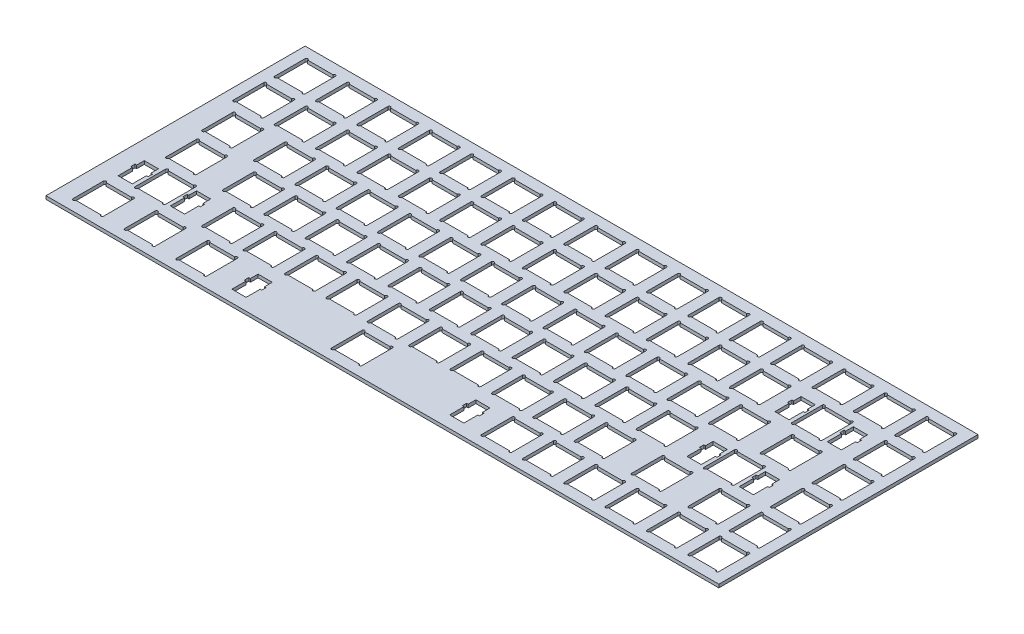
from build123d import *

# Parameters (mm, degrees)
SKETCH_1_W      = 309
SKETCH_1_H      = 119
EXTRUDE_1_DEPTH = 1.5


with BuildPart() as part:
    # Эскиз1 → Бобышка-Вытянуть1 (new body)
    with BuildSketch(Plane(origin=(0, 0, 0), x_dir=(1, 0, 0), z_dir=(0, 1, 0))):
        with Locations((142.5, -47.5)):
            Rectangle(SKETCH_1_W, SKETCH_1_H)
        with BuildLine():
            Line((13.2, -7), (24.8, -7))
            ThreePointArc((24.8, -7), (25.4, -7.6), (26, -7))
            Line((26, -7), (26, 7))
            ThreePointArc((26, 7), (25.4, 7.6), (24.8, 7))
            Line((24.8, 7), (13.2, 7))
            ThreePointArc((13.2, 7), (12.6, 7.6), (12, 7))
            Line((12, 7), (12, -7))
            ThreePointArc((12, -7), (12.6, -7.6), (13.2, -7))
        make_face(mode=Mode.SUBTRACT)
        with BuildLine():
            Line((-7, 7), (-7, -7))
            ThreePointArc((-7, -7), (-6.4, -7.6), (-5.8, -7))
            Line((-5.8, -7), (5.8, -7))
            ThreePointArc((5.8, -7), (6.4, -7.6), (7, -7))
            Line((7, -7), (7, 7))
            ThreePointArc((7, 7), (6.4, 7.6), (5.8, 7))
            Line((5.8, 7), (-5.8, 7))
            ThreePointArc((-5.8, 7), (-6.4, 7.6), (-7, 7))
        make_face(mode=Mode.SUBTRACT)
        with BuildLine():
            Line((32.2, -7), (43.8, -7))
            ThreePointArc((43.8, -7), (44.4, -7.6), (45, -7))
            Line((45, -7), (45, 7))
            ThreePointArc((45, 7), (44.4, 7.6), (43.8, 7))
            Line((43.8, 7), (32.2, 7))
            ThreePointArc((32.2, 7), (31.6, 7.6), (31, 7))
            Line((31, 7), (31, -7))
            ThreePointArc((31, -7), (31.6, -7.6), (32.2, -7))
        make_face(mode=Mode.SUBTRACT)
        with BuildLine():
            Line((51.2, -7), (62.8, -7))
            ThreePointArc((62.8, -7), (63.4, -7.6), (64, -7))
            Line((64, -7), (64, 7))
            ThreePointArc((64, 7), (63.4, 7.6), (62.8, 7))
            Line((62.8, 7), (51.2, 7))
            ThreePointArc((51.2, 7), (50.6, 7.6), (50, 7))
            Line((50, 7), (50, -7))
            ThreePointArc((50, -7), (50.6, -7.6), (51.2, -7))
        make_face(mode=Mode.SUBTRACT)
        with BuildLine():
            Line((70.2, -7), (81.8, -7))
            ThreePointArc((81.8, -7), (82.4, -7.6), (83, -7))
            Line((83, -7), (83, 7))
            ThreePointArc((83, 7), (82.4, 7.6), (81.8, 7))
            Line((81.8, 7), (70.2, 7))
            ThreePointArc((70.2, 7), (69.6, 7.6), (69, 7))
            Line((69, 7), (69, -7))
            ThreePointArc((69, -7), (69.6, -7.6), (70.2, -7))
        make_face(mode=Mode.SUBTRACT)
        with BuildLine():
            Line((89.2, -7), (100.8, -7))
            ThreePointArc((100.8, -7), (101.4, -7.6), (102, -7))
            Line((102, -7), (102, 7))
            ThreePointArc((102, 7), (101.4, 7.6), (100.8, 7))
            Line((100.8, 7), (89.2, 7))
            ThreePointArc((89.2, 7), (88.6, 7.6), (88, 7))
            Line((88, 7), (88, -7))
            ThreePointArc((88, -7), (88.6, -7.6), (89.2, -7))
        make_face(mode=Mode.SUBTRACT)
        with BuildLine():
            Line((108.2, -7), (119.8, -7))
            ThreePointArc((119.8, -7), (120.4, -7.6), (121, -7))
            Line((121, -7), (121, 7))
            ThreePointArc((121, 7), (120.4, 7.6), (119.8, 7))
            Line((119.8, 7), (108.2, 7))
            ThreePointArc((108.2, 7), (107.6, 7.6), (107, 7))
            Line((107, 7), (107, -7))
            ThreePointArc((107, -7), (107.6, -7.6), (108.2, -7))
        make_face(mode=Mode.SUBTRACT)
        with BuildLine():
            Line((127.2, -7), (138.8, -7))
            ThreePointArc((138.8, -7), (139.4, -7.6), (140, -7))
            Line((140, -7), (140, 7))
            ThreePointArc((140, 7), (139.4, 7.6), (138.8, 7))
            Line((138.8, 7), (127.2, 7))
            ThreePointArc((127.2, 7), (126.6, 7.6), (126, 7))
            Line((126, 7), (126, -7))
            ThreePointArc((126, -7), (126.6, -7.6), (127.2, -7))
        make_face(mode=Mode.SUBTRACT)
        with BuildLine():
            Line((146.2, -7), (157.8, -7))
            ThreePointArc((157.8, -7), (158.4, -7.6), (159, -7))
            Line((159, -7), (159, 7))
            ThreePointArc((159, 7), (158.4, 7.6), (157.8, 7))
            Line((157.8, 7), (146.2, 7))
            ThreePointArc((146.2, 7), (145.6, 7.6), (145, 7))
            Line((145, 7), (145, -7))
            ThreePointArc((145, -7), (145.6, -7.6), (146.2, -7))
        make_face(mode=Mode.SUBTRACT)
        with BuildLine():
            Line((165.2, -7), (176.8, -7))
            ThreePointArc((176.8, -7), (177.4, -7.6), (178, -7))
            Line((178, -7), (178, 7))
            ThreePointArc((178, 7), (177.4, 7.6), (176.8, 7))
            Line((176.8, 7), (165.2, 7))
            ThreePointArc((165.2, 7), (164.6, 7.6), (164, 7))
            Line((164, 7), (164, -7))
            ThreePointArc((164, -7), (164.6, -7.6), (165.2, -7))
        make_face(mode=Mode.SUBTRACT)
        with BuildLine():
            Line((184.2, -7), (195.8, -7))
            ThreePointArc((195.8, -7), (196.4, -7.6), (197, -7))
            Line((197, -7), (197, 7))
            ThreePointArc((197, 7), (196.4, 7.6), (195.8, 7))
            Line((195.8, 7), (184.2, 7))
            ThreePointArc((184.2, 7), (183.6, 7.6), (183, 7))
            Line((183, 7), (183, -7))
            ThreePointArc((183, -7), (183.6, -7.6), (184.2, -7))
        make_face(mode=Mode.SUBTRACT)
        with BuildLine():
            Line((203.2, -7), (214.8, -7))
            ThreePointArc((214.8, -7), (215.4, -7.6), (216, -7))
            Line((216, -7), (216, 7))
            ThreePointArc((216, 7), (215.4, 7.6), (214.8, 7))
            Line((214.8, 7), (203.2, 7))
            ThreePointArc((203.2, 7), (202.6, 7.6), (202, 7))
            Line((202, 7), (202, -7))
            ThreePointArc((202, -7), (202.6, -7.6), (203.2, -7))
        make_face(mode=Mode.SUBTRACT)
        with BuildLine():
            Line((222.2, -7), (233.8, -7))
            ThreePointArc((233.8, -7), (234.4, -7.6), (235, -7))
            Line((235, -7), (235, 7))
            ThreePointArc((235, 7), (234.4, 7.6), (233.8, 7))
            Line((233.8, 7), (222.2, 7))
            ThreePointArc((222.2, 7), (221.6, 7.6), (221, 7))
            Line((221, 7), (221, -7))
            ThreePointArc((221, -7), (221.6, -7.6), (222.2, -7))
        make_face(mode=Mode.SUBTRACT)
        with BuildLine():
            Line((241.2, -7), (252.8, -7))
            ThreePointArc((252.8, -7), (253.4, -7.6), (254, -7))
            Line((254, -7), (254, 7))
            ThreePointArc((254, 7), (253.4, 7.6), (252.8, 7))
            Line((252.8, 7), (241.2, 7))
            ThreePointArc((241.2, 7), (240.6, 7.6), (240, 7))
            Line((240, 7), (240, -7))
            ThreePointArc((240, -7), (240.6, -7.6), (241.2, -7))
        make_face(mode=Mode.SUBTRACT)
        with BuildLine():
            Line((260.2, -7), (271.8, -7))
            ThreePointArc((271.8, -7), (272.4, -7.6), (273, -7))
            Line((273, -7), (273, 7))
            ThreePointArc((273, 7), (272.4, 7.6), (271.8, 7))
            Line((271.8, 7), (260.2, 7))
            ThreePointArc((260.2, 7), (259.6, 7.6), (259, 7))
            Line((259, 7), (259, -7))
            ThreePointArc((259, -7), (259.6, -7.6), (260.2, -7))
        make_face(mode=Mode.SUBTRACT)
        with BuildLine():
            Line((279.2, -7), (290.8, -7))
            ThreePointArc((290.8, -7), (291.4, -7.6), (292, -7))
            Line((292, -7), (292, 7))
            ThreePointArc((292, 7), (291.4, 7.6), (290.8, 7))
            Line((290.8, 7), (279.2, 7))
            ThreePointArc((279.2, 7), (278.6, 7.6), (278, 7))
            Line((278, 7), (278, -7))
            ThreePointArc((278, -7), (278.6, -7.6), (279.2, -7))
        make_face(mode=Mode.SUBTRACT)
        with BuildLine():
            Line((279.2, -26), (290.8, -26))
            ThreePointArc((290.8, -26), (291.4, -26.6), (292, -26))
            Line((292, -26), (292, -12))
            ThreePointArc((292, -12), (291.4, -11.4), (290.8, -12))
            Line((290.8, -12), (279.2, -12))
            ThreePointArc((279.2, -12), (278.6, -11.4), (278, -12))
            Line((278, -12), (278, -26))
            ThreePointArc((278, -26), (278.6, -26.6), (279.2, -26))
        make_face(mode=Mode.SUBTRACT)
        with BuildLine():
            Line((279.2, -45), (290.8, -45))
            ThreePointArc((290.8, -45), (291.4, -45.6), (292, -45))
            Line((292, -45), (292, -31))
            ThreePointArc((292, -31), (291.4, -30.4), (290.8, -31))
            Line((290.8, -31), (279.2, -31))
            ThreePointArc((279.2, -31), (278.6, -30.4), (278, -31))
            Line((278, -31), (278, -45))
            ThreePointArc((278, -45), (278.6, -45.6), (279.2, -45))
        make_face(mode=Mode.SUBTRACT)
        with BuildLine():
            Line((279.2, -64), (290.8, -64))
            ThreePointArc((290.8, -64), (291.4, -64.6), (292, -64))
            Line((292, -64), (292, -50))
            ThreePointArc((292, -50), (291.4, -49.4), (290.8, -50))
            Line((290.8, -50), (279.2, -50))
            ThreePointArc((279.2, -50), (278.6, -49.4), (278, -50))
            Line((278, -50), (278, -64))
            ThreePointArc((278, -64), (278.6, -64.6), (279.2, -64))
        make_face(mode=Mode.SUBTRACT)
        with BuildLine():
            Line((279.2, -83), (290.8, -83))
            ThreePointArc((290.8, -83), (291.4, -83.6), (292, -83))
            Line((292, -83), (292, -69))
            ThreePointArc((292, -69), (291.4, -68.4), (290.8, -69))
            Line((290.8, -69), (279.2, -69))
            ThreePointArc((279.2, -69), (278.6, -68.4), (278, -69))
            Line((278, -69), (278, -83))
            ThreePointArc((278, -83), (278.6, -83.6), (279.2, -83))
        make_face(mode=Mode.SUBTRACT)
        with BuildLine():
            Line((279.2, -102), (290.8, -102))
            ThreePointArc((290.8, -102), (291.4, -102.6), (292, -102))
            Line((292, -102), (292, -88))
            ThreePointArc((292, -88), (291.4, -87.4), (290.8, -88))
            Line((290.8, -88), (279.2, -88))
            ThreePointArc((279.2, -88), (278.6, -87.4), (278, -88))
            Line((278, -88), (278, -102))
            ThreePointArc((278, -102), (278.6, -102.6), (279.2, -102))
        make_face(mode=Mode.SUBTRACT)
        with BuildLine():
            Line((-7, -12), (-7, -26))
            ThreePointArc((-7, -26), (-6.4, -26.6), (-5.8, -26))
            Line((-5.8, -26), (5.8, -26))
            ThreePointArc((5.8, -26), (6.4, -26.6), (7, -26))
            Line((7, -26), (7, -12))
            ThreePointArc((7, -12), (6.4, -11.4), (5.8, -12))
            Line((5.8, -12), (-5.8, -12))
            ThreePointArc((-5.8, -12), (-6.4, -11.4), (-7, -12))
        make_face(mode=Mode.SUBTRACT)
        with BuildLine():
            Line((12, -12), (12, -26))
            ThreePointArc((12, -26), (12.6, -26.6), (13.2, -26))
            Line((13.2, -26), (24.8, -26))
            ThreePointArc((24.8, -26), (25.4, -26.6), (26, -26))
            Line((26, -26), (26, -12))
            ThreePointArc((26, -12), (25.4, -11.4), (24.8, -12))
            Line((24.8, -12), (13.2, -12))
            ThreePointArc((13.2, -12), (12.6, -11.4), (12, -12))
        make_face(mode=Mode.SUBTRACT)
        with BuildLine():
            Line((31, -12), (31, -26))
            ThreePointArc((31, -26), (31.6, -26.6), (32.2, -26))
            Line((32.2, -26), (43.8, -26))
            ThreePointArc((43.8, -26), (44.4, -26.6), (45, -26))
            Line((45, -26), (45, -12))
            ThreePointArc((45, -12), (44.4, -11.4), (43.8, -12))
            Line((43.8, -12), (32.2, -12))
            ThreePointArc((32.2, -12), (31.6, -11.4), (31, -12))
        make_face(mode=Mode.SUBTRACT)
        with BuildLine():
            Line((50, -12), (50, -26))
            ThreePointArc((50, -26), (50.6, -26.6), (51.2, -26))
            Line((51.2, -26), (62.8, -26))
            ThreePointArc((62.8, -26), (63.4, -26.6), (64, -26))
            Line((64, -26), (64, -12))
            ThreePointArc((64, -12), (63.4, -11.4), (62.8, -12))
            Line((62.8, -12), (51.2, -12))
            ThreePointArc((51.2, -12), (50.6, -11.4), (50, -12))
        make_face(mode=Mode.SUBTRACT)
        with BuildLine():
            Line((69, -12), (69, -26))
            ThreePointArc((69, -26), (69.6, -26.6), (70.2, -26))
            Line((70.2, -26), (81.8, -26))
            ThreePointArc((81.8, -26), (82.4, -26.6), (83, -26))
            Line((83, -26), (83, -12))
            ThreePointArc((83, -12), (82.4, -11.4), (81.8, -12))
            Line((81.8, -12), (70.2, -12))
            ThreePointArc((70.2, -12), (69.6, -11.4), (69, -12))
        make_face(mode=Mode.SUBTRACT)
        with BuildLine():
            Line((88, -12), (88, -26))
            ThreePointArc((88, -26), (88.6, -26.6), (89.2, -26))
            Line((89.2, -26), (100.8, -26))
            ThreePointArc((100.8, -26), (101.4, -26.6), (102, -26))
            Line((102, -26), (102, -12))
            ThreePointArc((102, -12), (101.4, -11.4), (100.8, -12))
            Line((100.8, -12), (89.2, -12))
            ThreePointArc((89.2, -12), (88.6, -11.4), (88, -12))
        make_face(mode=Mode.SUBTRACT)
        with BuildLine():
            Line((107, -12), (107, -26))
            ThreePointArc((107, -26), (107.6, -26.6), (108.2, -26))
            Line((108.2, -26), (119.8, -26))
            ThreePointArc((119.8, -26), (120.4, -26.6), (121, -26))
            Line((121, -26), (121, -12))
            ThreePointArc((121, -12), (120.4, -11.4), (119.8, -12))
            Line((119.8, -12), (108.2, -12))
            ThreePointArc((108.2, -12), (107.6, -11.4), (107, -12))
        make_face(mode=Mode.SUBTRACT)
        with BuildLine():
            Line((126, -12), (126, -26))
            ThreePointArc((126, -26), (126.6, -26.6), (127.2, -26))
            Line((127.2, -26), (138.8, -26))
            ThreePointArc((138.8, -26), (139.4, -26.6), (140, -26))
            Line((140, -26), (140, -12))
            ThreePointArc((140, -12), (139.4, -11.4), (138.8, -12))
            Line((138.8, -12), (127.2, -12))
            ThreePointArc((127.2, -12), (126.6, -11.4), (126, -12))
        make_face(mode=Mode.SUBTRACT)
        with BuildLine():
            Line((145, -12), (145, -26))
            ThreePointArc((145, -26), (145.6, -26.6), (146.2, -26))
            Line((146.2, -26), (157.8, -26))
            ThreePointArc((157.8, -26), (158.4, -26.6), (159, -26))
            Line((159, -26), (159, -12))
            ThreePointArc((159, -12), (158.4, -11.4), (157.8, -12))
            Line((157.8, -12), (146.2, -12))
            ThreePointArc((146.2, -12), (145.6, -11.4), (145, -12))
        make_face(mode=Mode.SUBTRACT)
        with BuildLine():
            Line((164, -12), (164, -26))
            ThreePointArc((164, -26), (164.6, -26.6), (165.2, -26))
            Line((165.2, -26), (176.8, -26))
            ThreePointArc((176.8, -26), (177.4, -26.6), (178, -26))
            Line((178, -26), (178, -12))
            ThreePointArc((178, -12), (177.4, -11.4), (176.8, -12))
            Line((176.8, -12), (165.2, -12))
            ThreePointArc((165.2, -12), (164.6, -11.4), (164, -12))
        make_face(mode=Mode.SUBTRACT)
        with BuildLine():
            Line((183, -12), (183, -26))
            ThreePointArc((183, -26), (183.6, -26.6), (184.2, -26))
            Line((184.2, -26), (195.8, -26))
            ThreePointArc((195.8, -26), (196.4, -26.6), (197, -26))
            Line((197, -26), (197, -12))
            ThreePointArc((197, -12), (196.4, -11.4), (195.8, -12))
            Line((195.8, -12), (184.2, -12))
            ThreePointArc((184.2, -12), (183.6, -11.4), (183, -12))
        make_face(mode=Mode.SUBTRACT)
        with BuildLine():
            Line((202, -12), (202, -26))
            ThreePointArc((202, -26), (202.6, -26.6), (203.2, -26))
            Line((203.2, -26), (214.8, -26))
            ThreePointArc((214.8, -26), (215.4, -26.6), (216, -26))
            Line((216, -26), (216, -12))
            ThreePointArc((216, -12), (215.4, -11.4), (214.8, -12))
            Line((214.8, -12), (203.2, -12))
            ThreePointArc((203.2, -12), (202.6, -11.4), (202, -12))
        make_face(mode=Mode.SUBTRACT)
        with BuildLine():
            Line((221, -12), (221, -26))
            ThreePointArc((221, -26), (221.6, -26.6), (222.2, -26))
            Line((222.2, -26), (233.8, -26))
            ThreePointArc((233.8, -26), (234.4, -26.6), (235, -26))
            Line((235, -26), (235, -12))
            ThreePointArc((235, -12), (234.4, -11.4), (233.8, -12))
            Line((233.8, -12), (222.2, -12))
            ThreePointArc((222.2, -12), (221.6, -11.4), (221, -12))
        make_face(mode=Mode.SUBTRACT)
        with BuildLine():
            Line((260.2, -102), (271.8, -102))
            ThreePointArc((271.8, -102), (272.4, -102.6), (273, -102))
            Line((273, -102), (273, -88))
            ThreePointArc((273, -88), (272.4, -87.4), (271.8, -88))
            Line((271.8, -88), (260.2, -88))
            ThreePointArc((260.2, -88), (259.6, -87.4), (259, -88))
            Line((259, -88), (259, -102))
            ThreePointArc((259, -102), (259.6, -102.6), (260.2, -102))
        make_face(mode=Mode.SUBTRACT)
        with BuildLine():
            Line((241.2, -102), (252.8, -102))
            ThreePointArc((252.8, -102), (253.4, -102.6), (254, -102))
            Line((254, -102), (254, -88))
            ThreePointArc((254, -88), (253.4, -87.4), (252.8, -88))
            Line((252.8, -88), (241.2, -88))
            ThreePointArc((241.2, -88), (240.6, -87.4), (240, -88))
            Line((240, -88), (240, -102))
            ThreePointArc((240, -102), (240.6, -102.6), (241.2, -102))
        make_face(mode=Mode.SUBTRACT)
        with BuildLine():
            Line((222.2, -102), (233.8, -102))
            ThreePointArc((233.8, -102), (234.4, -102.6), (235, -102))
            Line((235, -102), (235, -88))
            ThreePointArc((235, -88), (234.4, -87.4), (233.8, -88))
            Line((233.8, -88), (222.2, -88))
            ThreePointArc((222.2, -88), (221.6, -87.4), (221, -88))
            Line((221, -88), (221, -102))
            ThreePointArc((221, -102), (221.6, -102.6), (222.2, -102))
        make_face(mode=Mode.SUBTRACT)
        with BuildLine():
            Line((203.2, -102), (214.8, -102))
            ThreePointArc((214.8, -102), (215.4, -102.6), (216, -102))
            Line((216, -102), (216, -88))
            ThreePointArc((216, -88), (215.4, -87.4), (214.8, -88))
            Line((214.8, -88), (203.2, -88))
            ThreePointArc((203.2, -88), (202.6, -87.4), (202, -88))
            Line((202, -88), (202, -102))
            ThreePointArc((202, -102), (202.6, -102.6), (203.2, -102))
        make_face(mode=Mode.SUBTRACT)
        with BuildLine():
            Line((184.2, -102), (195.8, -102))
            ThreePointArc((195.8, -102), (196.4, -102.6), (197, -102))
            Line((197, -102), (197, -88))
            ThreePointArc((197, -88), (196.4, -87.4), (195.8, -88))
            Line((195.8, -88), (184.2, -88))
            ThreePointArc((184.2, -88), (183.6, -87.4), (183, -88))
            Line((183, -88), (183, -102))
            ThreePointArc((183, -102), (183.6, -102.6), (184.2, -102))
        make_face(mode=Mode.SUBTRACT)
        with BuildLine():
            Line((263.5, -26), (263.5, -12))
            ThreePointArc((263.5, -12), (262.9, -11.4), (262.3, -12))
            Line((262.3, -12), (250.7, -12))
            ThreePointArc((250.7, -12), (250.1, -11.4), (249.5, -12))
            Line((249.5, -12), (249.5, -26))
            ThreePointArc((249.5, -26), (250.1, -26.6), (250.7, -26))
            Line((250.7, -26), (262.3, -26))
            ThreePointArc((262.3, -26), (262.9, -26.6), (263.5, -26))
        make_face(mode=Mode.SUBTRACT)
        with BuildLine():
            Line((11.75, -45), (11.75, -31))
            ThreePointArc((11.75, -31), (11.15, -30.4), (10.55, -31))
            Line((10.55, -31), (-1.05, -31))
            ThreePointArc((-1.05, -31), (-1.65, -30.4), (-2.25, -31))
            Line((-2.25, -31), (-2.25, -45))
            ThreePointArc((-2.25, -45), (-1.65, -45.6), (-1.05, -45))
            Line((-1.05, -45), (10.55, -45))
            ThreePointArc((10.55, -45), (11.15, -45.6), (11.75, -45))
        make_face(mode=Mode.SUBTRACT)
        with BuildLine():
            Line((35.5, -45), (35.5, -31))
            ThreePointArc((35.5, -31), (34.9, -30.4), (34.3, -31))
            Line((34.3, -31), (22.7, -31))
            ThreePointArc((22.7, -31), (22.1, -30.4), (21.5, -31))
            Line((21.5, -31), (21.5, -45))
            ThreePointArc((21.5, -45), (22.1, -45.6), (22.7, -45))
            Line((22.7, -45), (34.3, -45))
            ThreePointArc((34.3, -45), (34.9, -45.6), (35.5, -45))
        make_face(mode=Mode.SUBTRACT)
        with BuildLine():
            Line((54.5, -45), (54.5, -31))
            ThreePointArc((54.5, -31), (53.9, -30.4), (53.3, -31))
            Line((53.3, -31), (41.7, -31))
            ThreePointArc((41.7, -31), (41.1, -30.4), (40.5, -31))
            Line((40.5, -31), (40.5, -45))
            ThreePointArc((40.5, -45), (41.1, -45.6), (41.7, -45))
            Line((41.7, -45), (53.3, -45))
            ThreePointArc((53.3, -45), (53.9, -45.6), (54.5, -45))
        make_face(mode=Mode.SUBTRACT)
        with BuildLine():
            Line((73.5, -45), (73.5, -31))
            ThreePointArc((73.5, -31), (72.9, -30.4), (72.3, -31))
            Line((72.3, -31), (60.7, -31))
            ThreePointArc((60.7, -31), (60.1, -30.4), (59.5, -31))
            Line((59.5, -31), (59.5, -45))
            ThreePointArc((59.5, -45), (60.1, -45.6), (60.7, -45))
            Line((60.7, -45), (72.3, -45))
            ThreePointArc((72.3, -45), (72.9, -45.6), (73.5, -45))
        make_face(mode=Mode.SUBTRACT)
        with BuildLine():
            Line((92.5, -45), (92.5, -31))
            ThreePointArc((92.5, -31), (91.9, -30.4), (91.3, -31))
            Line((91.3, -31), (79.7, -31))
            ThreePointArc((79.7, -31), (79.1, -30.4), (78.5, -31))
            Line((78.5, -31), (78.5, -45))
            ThreePointArc((78.5, -45), (79.1, -45.6), (79.7, -45))
            Line((79.7, -45), (91.3, -45))
            ThreePointArc((91.3, -45), (91.9, -45.6), (92.5, -45))
        make_face(mode=Mode.SUBTRACT)
        with BuildLine():
            Line((111.5, -45), (111.5, -31))
            ThreePointArc((111.5, -31), (110.9, -30.4), (110.3, -31))
            Line((110.3, -31), (98.7, -31))
            ThreePointArc((98.7, -31), (98.1, -30.4), (97.5, -31))
            Line((97.5, -31), (97.5, -45))
            ThreePointArc((97.5, -45), (98.1, -45.6), (98.7, -45))
            Line((98.7, -45), (110.3, -45))
            ThreePointArc((110.3, -45), (110.9, -45.6), (111.5, -45))
        make_face(mode=Mode.SUBTRACT)
        with BuildLine():
            Line((130.5, -45), (130.5, -31))
            ThreePointArc((130.5, -31), (129.9, -30.4), (129.3, -31))
            Line((129.3, -31), (117.7, -31))
            ThreePointArc((117.7, -31), (117.1, -30.4), (116.5, -31))
            Line((116.5, -31), (116.5, -45))
            ThreePointArc((116.5, -45), (117.1, -45.6), (117.7, -45))
            Line((117.7, -45), (129.3, -45))
            ThreePointArc((129.3, -45), (129.9, -45.6), (130.5, -45))
        make_face(mode=Mode.SUBTRACT)
        with BuildLine():
            Line((149.5, -45), (149.5, -31))
            ThreePointArc((149.5, -31), (148.9, -30.4), (148.3, -31))
            Line((148.3, -31), (136.7, -31))
            ThreePointArc((136.7, -31), (136.1, -30.4), (135.5, -31))
            Line((135.5, -31), (135.5, -45))
            ThreePointArc((135.5, -45), (136.1, -45.6), (136.7, -45))
            Line((136.7, -45), (148.3, -45))
            ThreePointArc((148.3, -45), (148.9, -45.6), (149.5, -45))
        make_face(mode=Mode.SUBTRACT)
        with BuildLine():
            Line((168.5, -45), (168.5, -31))
            ThreePointArc((168.5, -31), (167.9, -30.4), (167.3, -31))
            Line((167.3, -31), (155.7, -31))
            ThreePointArc((155.7, -31), (155.1, -30.4), (154.5, -31))
            Line((154.5, -31), (154.5, -45))
            ThreePointArc((154.5, -45), (155.1, -45.6), (155.7, -45))
            Line((155.7, -45), (167.3, -45))
            ThreePointArc((167.3, -45), (167.9, -45.6), (168.5, -45))
        make_face(mode=Mode.SUBTRACT)
        with BuildLine():
            Line((187.5, -45), (187.5, -31))
            ThreePointArc((187.5, -31), (186.9, -30.4), (186.3, -31))
            Line((186.3, -31), (174.7, -31))
            ThreePointArc((174.7, -31), (174.1, -30.4), (173.5, -31))
            Line((173.5, -31), (173.5, -45))
            ThreePointArc((173.5, -45), (174.1, -45.6), (174.7, -45))
            Line((174.7, -45), (186.3, -45))
            ThreePointArc((186.3, -45), (186.9, -45.6), (187.5, -45))
        make_face(mode=Mode.SUBTRACT)
        with BuildLine():
            Line((206.5, -45), (206.5, -31))
            ThreePointArc((206.5, -31), (205.9, -30.4), (205.3, -31))
            Line((205.3, -31), (193.7, -31))
            ThreePointArc((193.7, -31), (193.1, -30.4), (192.5, -31))
            Line((192.5, -31), (192.5, -45))
            ThreePointArc((192.5, -45), (193.1, -45.6), (193.7, -45))
            Line((193.7, -45), (205.3, -45))
            ThreePointArc((205.3, -45), (205.9, -45.6), (206.5, -45))
        make_face(mode=Mode.SUBTRACT)
        with BuildLine():
            Line((225.5, -45), (225.5, -31))
            ThreePointArc((225.5, -31), (224.9, -30.4), (224.3, -31))
            Line((224.3, -31), (212.7, -31))
            ThreePointArc((212.7, -31), (212.1, -30.4), (211.5, -31))
            Line((211.5, -31), (211.5, -45))
            ThreePointArc((211.5, -45), (212.1, -45.6), (212.7, -45))
            Line((212.7, -45), (224.3, -45))
            ThreePointArc((224.3, -45), (224.9, -45.6), (225.5, -45))
        make_face(mode=Mode.SUBTRACT)
        with BuildLine():
            Line((244.5, -45), (244.5, -31))
            ThreePointArc((244.5, -31), (243.9, -30.4), (243.3, -31))
            Line((243.3, -31), (231.7, -31))
            ThreePointArc((231.7, -31), (231.1, -30.4), (230.5, -31))
            Line((230.5, -31), (230.5, -45))
            ThreePointArc((230.5, -45), (231.1, -45.6), (231.7, -45))
            Line((231.7, -45), (243.3, -45))
            ThreePointArc((243.3, -45), (243.9, -45.6), (244.5, -45))
        make_face(mode=Mode.SUBTRACT)
        with BuildLine():
            Line((268.25, -45), (268.25, -31))
            ThreePointArc((268.25, -31), (267.65, -30.4), (267.05, -31))
            Line((267.05, -31), (255.45, -31))
            ThreePointArc((255.45, -31), (254.85, -30.4), (254.25, -31))
            Line((254.25, -31), (254.25, -45))
            ThreePointArc((254.25, -45), (254.85, -45.6), (255.45, -45))
            Line((255.45, -45), (267.05, -45))
            ThreePointArc((267.05, -45), (267.65, -45.6), (268.25, -45))
        make_face(mode=Mode.SUBTRACT)
        with BuildLine():
            Line((14.125, -64), (14.125, -50))
            ThreePointArc((14.125, -50), (13.525, -49.4), (12.925, -50))
            Line((12.925, -50), (1.325, -50))
            ThreePointArc((1.325, -50), (0.725, -49.4), (0.125, -50))
            Line((0.125, -50), (0.125, -64))
            ThreePointArc((0.125, -64), (0.725, -64.6), (1.325, -64))
            Line((1.325, -64), (12.925, -64))
            ThreePointArc((12.925, -64), (13.525, -64.6), (14.125, -64))
        make_face(mode=Mode.SUBTRACT)
        with BuildLine():
            Line((40.25, -64), (40.25, -50))
            ThreePointArc((40.25, -50), (39.65, -49.4), (39.05, -50))
            Line((39.05, -50), (27.45, -50))
            ThreePointArc((27.45, -50), (26.85, -49.4), (26.25, -50))
            Line((26.25, -50), (26.25, -64))
            ThreePointArc((26.25, -64), (26.85, -64.6), (27.45, -64))
            Line((27.45, -64), (39.05, -64))
            ThreePointArc((39.05, -64), (39.65, -64.6), (40.25, -64))
        make_face(mode=Mode.SUBTRACT)
        with BuildLine():
            Line((59.25, -64), (59.25, -50))
            ThreePointArc((59.25, -50), (58.65, -49.4), (58.05, -50))
            Line((58.05, -50), (46.45, -50))
            ThreePointArc((46.45, -50), (45.85, -49.4), (45.25, -50))
            Line((45.25, -50), (45.25, -64))
            ThreePointArc((45.25, -64), (45.85, -64.6), (46.45, -64))
            Line((46.45, -64), (58.05, -64))
            ThreePointArc((58.05, -64), (58.65, -64.6), (59.25, -64))
        make_face(mode=Mode.SUBTRACT)
        with BuildLine():
            Line((78.25, -64), (78.25, -50))
            ThreePointArc((78.25, -50), (77.65, -49.4), (77.05, -50))
            Line((77.05, -50), (65.45, -50))
            ThreePointArc((65.45, -50), (64.85, -49.4), (64.25, -50))
            Line((64.25, -50), (64.25, -64))
            ThreePointArc((64.25, -64), (64.85, -64.6), (65.45, -64))
            Line((65.45, -64), (77.05, -64))
            ThreePointArc((77.05, -64), (77.65, -64.6), (78.25, -64))
        make_face(mode=Mode.SUBTRACT)
        with BuildLine():
            Line((97.25, -64), (97.25, -50))
            ThreePointArc((97.25, -50), (96.65, -49.4), (96.05, -50))
            Line((96.05, -50), (84.45, -50))
            ThreePointArc((84.45, -50), (83.85, -49.4), (83.25, -50))
            Line((83.25, -50), (83.25, -64))
            ThreePointArc((83.25, -64), (83.85, -64.6), (84.45, -64))
            Line((84.45, -64), (96.05, -64))
            ThreePointArc((96.05, -64), (96.65, -64.6), (97.25, -64))
        make_face(mode=Mode.SUBTRACT)
        with BuildLine():
            Line((116.25, -64), (116.25, -50))
            ThreePointArc((116.25, -50), (115.65, -49.4), (115.05, -50))
            Line((115.05, -50), (103.45, -50))
            ThreePointArc((103.45, -50), (102.85, -49.4), (102.25, -50))
            Line((102.25, -50), (102.25, -64))
            ThreePointArc((102.25, -64), (102.85, -64.6), (103.45, -64))
            Line((103.45, -64), (115.05, -64))
            ThreePointArc((115.05, -64), (115.65, -64.6), (116.25, -64))
        make_face(mode=Mode.SUBTRACT)
        with BuildLine():
            Line((135.25, -64), (135.25, -50))
            ThreePointArc((135.25, -50), (134.65, -49.4), (134.05, -50))
            Line((134.05, -50), (122.45, -50))
            ThreePointArc((122.45, -50), (121.85, -49.4), (121.25, -50))
            Line((121.25, -50), (121.25, -64))
            ThreePointArc((121.25, -64), (121.85, -64.6), (122.45, -64))
            Line((122.45, -64), (134.05, -64))
            ThreePointArc((134.05, -64), (134.65, -64.6), (135.25, -64))
        make_face(mode=Mode.SUBTRACT)
        with BuildLine():
            Line((154.25, -64), (154.25, -50))
            ThreePointArc((154.25, -50), (153.65, -49.4), (153.05, -50))
            Line((153.05, -50), (141.45, -50))
            ThreePointArc((141.45, -50), (140.85, -49.4), (140.25, -50))
            Line((140.25, -50), (140.25, -64))
            ThreePointArc((140.25, -64), (140.85, -64.6), (141.45, -64))
            Line((141.45, -64), (153.05, -64))
            ThreePointArc((153.05, -64), (153.65, -64.6), (154.25, -64))
        make_face(mode=Mode.SUBTRACT)
        with BuildLine():
            Line((173.25, -64), (173.25, -50))
            ThreePointArc((173.25, -50), (172.65, -49.4), (172.05, -50))
            Line((172.05, -50), (160.45, -50))
            ThreePointArc((160.45, -50), (159.85, -49.4), (159.25, -50))
            Line((159.25, -50), (159.25, -64))
            ThreePointArc((159.25, -64), (159.85, -64.6), (160.45, -64))
            Line((160.45, -64), (172.05, -64))
            ThreePointArc((172.05, -64), (172.65, -64.6), (173.25, -64))
        make_face(mode=Mode.SUBTRACT)
        with BuildLine():
            Line((192.25, -64), (192.25, -50))
            ThreePointArc((192.25, -50), (191.65, -49.4), (191.05, -50))
            Line((191.05, -50), (179.45, -50))
            ThreePointArc((179.45, -50), (178.85, -49.4), (178.25, -50))
            Line((178.25, -50), (178.25, -64))
            ThreePointArc((178.25, -64), (178.85, -64.6), (179.45, -64))
            Line((179.45, -64), (191.05, -64))
            ThreePointArc((191.05, -64), (191.65, -64.6), (192.25, -64))
        make_face(mode=Mode.SUBTRACT)
        with BuildLine():
            Line((211.25, -64), (211.25, -50))
            ThreePointArc((211.25, -50), (210.65, -49.4), (210.05, -50))
            Line((210.05, -50), (198.45, -50))
            ThreePointArc((198.45, -50), (197.85, -49.4), (197.25, -50))
            Line((197.25, -50), (197.25, -64))
            ThreePointArc((197.25, -64), (197.85, -64.6), (198.45, -64))
            Line((198.45, -64), (210.05, -64))
            ThreePointArc((210.05, -64), (210.65, -64.6), (211.25, -64))
        make_face(mode=Mode.SUBTRACT)
        with BuildLine():
            Line((230.25, -64), (230.25, -50))
            ThreePointArc((230.25, -50), (229.65, -49.4), (229.05, -50))
            Line((229.05, -50), (217.45, -50))
            ThreePointArc((217.45, -50), (216.85, -49.4), (216.25, -50))
            Line((216.25, -50), (216.25, -64))
            ThreePointArc((216.25, -64), (216.85, -64.6), (217.45, -64))
            Line((217.45, -64), (229.05, -64))
            ThreePointArc((229.05, -64), (229.65, -64.6), (230.25, -64))
        make_face(mode=Mode.SUBTRACT)
        with BuildLine():
            Line((261.125, -64), (261.125, -50))
            ThreePointArc((261.125, -50), (260.525, -49.4), (259.925, -50))
            Line((259.925, -50), (248.325, -50))
            ThreePointArc((248.325, -50), (247.725, -49.4), (247.125, -50))
            Line((247.125, -50), (247.125, -64))
            ThreePointArc((247.125, -64), (247.725, -64.6), (248.325, -64))
            Line((248.325, -64), (259.925, -64))
            ThreePointArc((259.925, -64), (260.525, -64.6), (261.125, -64))
        make_face(mode=Mode.SUBTRACT)
        with BuildLine():
            Line((273, -83), (273, -69))
            ThreePointArc((273, -69), (272.4, -68.4), (271.8, -69))
            Line((271.8, -69), (260.2, -69))
            ThreePointArc((260.2, -69), (259.6, -68.4), (259, -69))
            Line((259, -69), (259, -83))
            ThreePointArc((259, -83), (259.6, -83.6), (260.2, -83))
            Line((260.2, -83), (271.8, -83))
            ThreePointArc((271.8, -83), (272.4, -83.6), (273, -83))
        make_face(mode=Mode.SUBTRACT)
        with BuildLine():
            Line((246.875, -83), (246.875, -69))
            ThreePointArc((246.875, -69), (246.275, -68.4), (245.675, -69))
            Line((245.675, -69), (234.075, -69))
            ThreePointArc((234.075, -69), (233.475, -68.4), (232.875, -69))
            Line((232.875, -69), (232.875, -83))
            ThreePointArc((232.875, -83), (233.475, -83.6), (234.075, -83))
            Line((234.075, -83), (245.675, -83))
            ThreePointArc((245.675, -83), (246.275, -83.6), (246.875, -83))
        make_face(mode=Mode.SUBTRACT)
        with BuildLine():
            Line((220.75, -83), (220.75, -69))
            ThreePointArc((220.75, -69), (220.15, -68.4), (219.55, -69))
            Line((219.55, -69), (207.95, -69))
            ThreePointArc((207.95, -69), (207.35, -68.4), (206.75, -69))
            Line((206.75, -69), (206.75, -83))
            ThreePointArc((206.75, -83), (207.35, -83.6), (207.95, -83))
            Line((207.95, -83), (219.55, -83))
            ThreePointArc((219.55, -83), (220.15, -83.6), (220.75, -83))
        make_face(mode=Mode.SUBTRACT)
        with BuildLine():
            Line((201.75, -83), (201.75, -69))
            ThreePointArc((201.75, -69), (201.15, -68.4), (200.55, -69))
            Line((200.55, -69), (188.95, -69))
            ThreePointArc((188.95, -69), (188.35, -68.4), (187.75, -69))
            Line((187.75, -69), (187.75, -83))
            ThreePointArc((187.75, -83), (188.35, -83.6), (188.95, -83))
            Line((188.95, -83), (200.55, -83))
            ThreePointArc((200.55, -83), (201.15, -83.6), (201.75, -83))
        make_face(mode=Mode.SUBTRACT)
        with BuildLine():
            Line((182.75, -83), (182.75, -69))
            ThreePointArc((182.75, -69), (182.15, -68.4), (181.55, -69))
            Line((181.55, -69), (169.95, -69))
            ThreePointArc((169.95, -69), (169.35, -68.4), (168.75, -69))
            Line((168.75, -69), (168.75, -83))
            ThreePointArc((168.75, -83), (169.35, -83.6), (169.95, -83))
            Line((169.95, -83), (181.55, -83))
            ThreePointArc((181.55, -83), (182.15, -83.6), (182.75, -83))
        make_face(mode=Mode.SUBTRACT)
        with BuildLine():
            Line((163.75, -83), (163.75, -69))
            ThreePointArc((163.75, -69), (163.15, -68.4), (162.55, -69))
            Line((162.55, -69), (150.95, -69))
            ThreePointArc((150.95, -69), (150.35, -68.4), (149.75, -69))
            Line((149.75, -69), (149.75, -83))
            ThreePointArc((149.75, -83), (150.35, -83.6), (150.95, -83))
            Line((150.95, -83), (162.55, -83))
            ThreePointArc((162.55, -83), (163.15, -83.6), (163.75, -83))
        make_face(mode=Mode.SUBTRACT)
        with BuildLine():
            Line((144.75, -83), (144.75, -69))
            ThreePointArc((144.75, -69), (144.15, -68.4), (143.55, -69))
            Line((143.55, -69), (131.95, -69))
            ThreePointArc((131.95, -69), (131.35, -68.4), (130.75, -69))
            Line((130.75, -69), (130.75, -83))
            ThreePointArc((130.75, -83), (131.35, -83.6), (131.95, -83))
            Line((131.95, -83), (143.55, -83))
            ThreePointArc((143.55, -83), (144.15, -83.6), (144.75, -83))
        make_face(mode=Mode.SUBTRACT)
        with BuildLine():
            Line((125.75, -83), (125.75, -69))
            ThreePointArc((125.75, -69), (125.15, -68.4), (124.55, -69))
            Line((124.55, -69), (112.95, -69))
            ThreePointArc((112.95, -69), (112.35, -68.4), (111.75, -69))
            Line((111.75, -69), (111.75, -83))
            ThreePointArc((111.75, -83), (112.35, -83.6), (112.95, -83))
            Line((112.95, -83), (124.55, -83))
            ThreePointArc((124.55, -83), (125.15, -83.6), (125.75, -83))
        make_face(mode=Mode.SUBTRACT)
        with BuildLine():
            Line((106.75, -83), (106.75, -69))
            ThreePointArc((106.75, -69), (106.15, -68.4), (105.55, -69))
            Line((105.55, -69), (93.95, -69))
            ThreePointArc((93.95, -69), (93.35, -68.4), (92.75, -69))
            Line((92.75, -69), (92.75, -83))
            ThreePointArc((92.75, -83), (93.35, -83.6), (93.95, -83))
            Line((93.95, -83), (105.55, -83))
            ThreePointArc((105.55, -83), (106.15, -83.6), (106.75, -83))
        make_face(mode=Mode.SUBTRACT)
        with BuildLine():
            Line((87.75, -83), (87.75, -69))
            ThreePointArc((87.75, -69), (87.15, -68.4), (86.55, -69))
            Line((86.55, -69), (74.95, -69))
            ThreePointArc((74.95, -69), (74.35, -68.4), (73.75, -69))
            Line((73.75, -69), (73.75, -83))
            ThreePointArc((73.75, -83), (74.35, -83.6), (74.95, -83))
            Line((74.95, -83), (86.55, -83))
            ThreePointArc((86.55, -83), (87.15, -83.6), (87.75, -83))
        make_face(mode=Mode.SUBTRACT)
        with BuildLine():
            Line((68.75, -83), (68.75, -69))
            ThreePointArc((68.75, -69), (68.15, -68.4), (67.55, -69))
            Line((67.55, -69), (55.95, -69))
            ThreePointArc((55.95, -69), (55.35, -68.4), (54.75, -69))
            Line((54.75, -69), (54.75, -83))
            ThreePointArc((54.75, -83), (55.35, -83.6), (55.95, -83))
            Line((55.95, -83), (67.55, -83))
            ThreePointArc((67.55, -83), (68.15, -83.6), (68.75, -83))
        make_face(mode=Mode.SUBTRACT)
        with BuildLine():
            Line((49.75, -83), (49.75, -69))
            ThreePointArc((49.75, -69), (49.15, -68.4), (48.55, -69))
            Line((48.55, -69), (36.95, -69))
            ThreePointArc((36.95, -69), (36.35, -68.4), (35.75, -69))
            Line((35.75, -69), (35.75, -83))
            ThreePointArc((35.75, -83), (36.35, -83.6), (36.95, -83))
            Line((36.95, -83), (48.55, -83))
            ThreePointArc((48.55, -83), (49.15, -83.6), (49.75, -83))
        make_face(mode=Mode.SUBTRACT)
        with BuildLine():
            Line((18.875, -83), (18.875, -69))
            ThreePointArc((18.875, -69), (18.275, -68.4), (17.675, -69))
            Line((17.675, -69), (6.075, -69))
            ThreePointArc((6.075, -69), (5.475, -68.4), (4.875, -69))
            Line((4.875, -69), (4.875, -83))
            ThreePointArc((4.875, -83), (5.475, -83.6), (6.075, -83))
            Line((6.075, -83), (17.675, -83))
            ThreePointArc((17.675, -83), (18.275, -83.6), (18.875, -83))
        make_face(mode=Mode.SUBTRACT)
        with BuildLine():
            Line((9.375, -102), (9.375, -88))
            ThreePointArc((9.375, -88), (8.775, -87.4), (8.175, -88))
            Line((8.175, -88), (-3.425, -88))
            ThreePointArc((-3.425, -88), (-4.025, -87.4), (-4.625, -88))
            Line((-4.625, -88), (-4.625, -102))
            ThreePointArc((-4.625, -102), (-4.025, -102.6), (-3.425, -102))
            Line((-3.425, -102), (8.175, -102))
            ThreePointArc((8.175, -102), (8.775, -102.6), (9.375, -102))
        make_face(mode=Mode.SUBTRACT)
        with BuildLine():
            Line((33.125, -102), (33.125, -88))
            ThreePointArc((33.125, -88), (32.525, -87.4), (31.925, -88))
            Line((31.925, -88), (20.325, -88))
            ThreePointArc((20.325, -88), (19.725, -87.4), (19.125, -88))
            Line((19.125, -88), (19.125, -102))
            ThreePointArc((19.125, -102), (19.725, -102.6), (20.325, -102))
            Line((20.325, -102), (31.925, -102))
            ThreePointArc((31.925, -102), (32.525, -102.6), (33.125, -102))
        make_face(mode=Mode.SUBTRACT)
        with BuildLine():
            Line((56.875, -102), (56.875, -88))
            ThreePointArc((56.875, -88), (56.275, -87.4), (55.675, -88))
            Line((55.675, -88), (44.075, -88))
            ThreePointArc((44.075, -88), (43.475, -87.4), (42.875, -88))
            Line((42.875, -88), (42.875, -102))
            ThreePointArc((42.875, -102), (43.475, -102.6), (44.075, -102))
            Line((44.075, -102), (55.675, -102))
            ThreePointArc((55.675, -102), (56.275, -102.6), (56.875, -102))
        make_face(mode=Mode.SUBTRACT)
        with BuildLine():
            Line((128.125, -102), (128.125, -88))
            ThreePointArc((128.125, -88), (127.525, -87.4), (126.925, -88))
            Line((126.925, -88), (115.325, -88))
            ThreePointArc((115.325, -88), (114.725, -87.4), (114.125, -88))
            Line((114.125, -88), (114.125, -102))
            ThreePointArc((114.125, -102), (114.725, -102.6), (115.325, -102))
            Line((115.325, -102), (126.925, -102))
            ThreePointArc((126.925, -102), (127.525, -102.6), (128.125, -102))
        make_face(mode=Mode.SUBTRACT)
        Polygon((67.125, -95), (67.875, -95), (67.875, -101.5), (74.375, -101.5), (74.375, -95), (75.125, -95), (75.125, -93), (74.375, -93), (74.375, -89.5), (67.875, -89.5), (67.875, -93), (67.125, -93), align=None, mode=Mode.SUBTRACT)
        Polygon((167.125, -95), (167.875, -95), (167.875, -101.5), (174.375, -101.5), (174.375, -95), (175.125, -95), (175.125, -93), (174.375, -93), (174.375, -89.5), (167.875, -89.5), (167.875, -93), (167.125, -93), align=None, mode=Mode.SUBTRACT)
        Polygon((19.875, -76), (20.625, -76), (20.625, -82.5), (27.125, -82.5), (27.125, -76), (27.875, -76), (27.875, -74), (27.125, -74), (27.125, -70.5), (20.625, -70.5), (20.625, -74), (19.875, -74), align=None, mode=Mode.SUBTRACT)
        Polygon((-4.125, -76), (-3.375, -76), (-3.375, -82.5), (3.125, -82.5), (3.125, -76), (3.875, -76), (3.875, -74), (3.125, -74), (3.125, -70.5), (-3.375, -70.5), (-3.375, -74), (-4.125, -74), align=None, mode=Mode.SUBTRACT)
        Polygon((238.125, -57), (238.875, -57), (238.875, -63.5), (245.375, -63.5), (245.375, -57), (246.125, -57), (246.125, -55), (245.375, -55), (245.375, -51.5), (238.875, -51.5), (238.875, -55), (238.125, -55), align=None, mode=Mode.SUBTRACT)
        Polygon((262.125, -57), (262.875, -57), (262.875, -63.5), (269.375, -63.5), (269.375, -57), (270.125, -57), (270.125, -55), (269.375, -55), (269.375, -51.5), (262.875, -51.5), (262.875, -55), (262.125, -55), align=None, mode=Mode.SUBTRACT)
        Polygon((240.5, -19), (241.25, -19), (241.25, -25.5), (247.75, -25.5), (247.75, -19), (248.5, -19), (248.5, -17), (247.75, -17), (247.75, -13.5), (241.25, -13.5), (241.25, -17), (240.5, -17), align=None, mode=Mode.SUBTRACT)
        Polygon((264.5, -19), (265.25, -19), (265.25, -25.5), (271.75, -25.5), (271.75, -19), (272.5, -19), (272.5, -17), (271.75, -17), (271.75, -13.5), (265.25, -13.5), (265.25, -17), (264.5, -17), align=None, mode=Mode.SUBTRACT)
    extrude(amount=EXTRUDE_1_DEPTH)


solid = part.part
